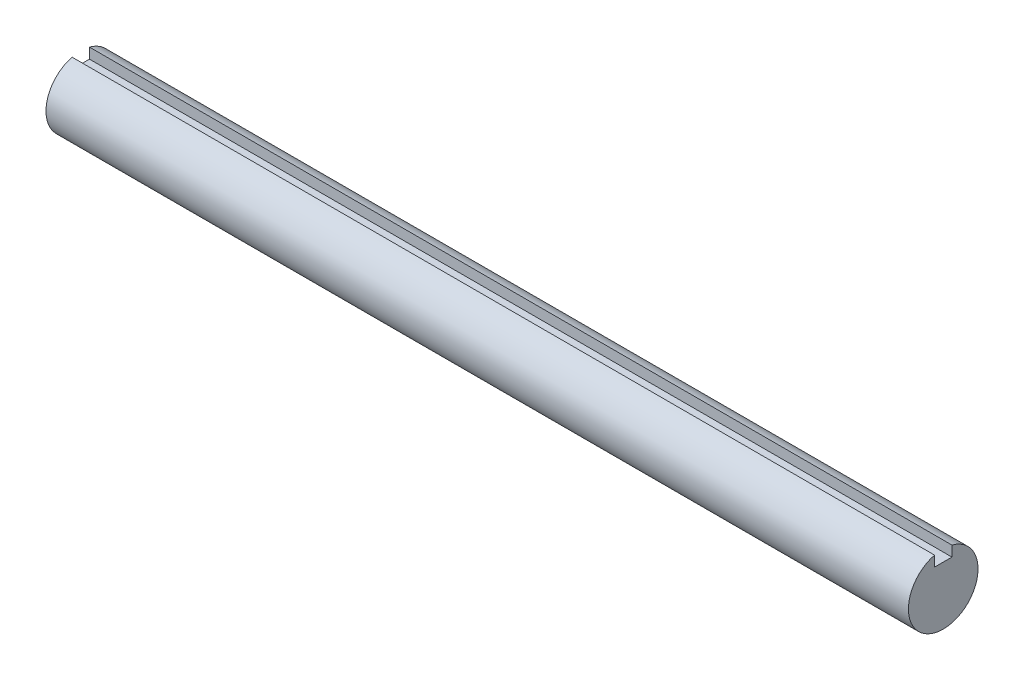
from build123d import *

# Parameters (mm, degrees)
BOSS_EXTRUDE1_DEPTH = 99.1235


with BuildPart() as part:
    # Sketch1 → Boss-Extrude1 (new body)
    with BuildSketch(Plane(origin=(0, 0, 0), x_dir=(0, 0, -1), z_dir=(1, 0, 0))):
        with BuildLine():
            Line((-1, 3.872983347), (-1, 2.672983347))
            Line((-1, 2.672983347), (1, 2.672983347))
            Line((1, 2.672983347), (1, 3.872983347))
            ThreePointArc((1, 3.872983347), (0, -4.000000001), (-1, 3.872983347))
        make_face()
    extrude(amount=BOSS_EXTRUDE1_DEPTH)


solid = part.part
